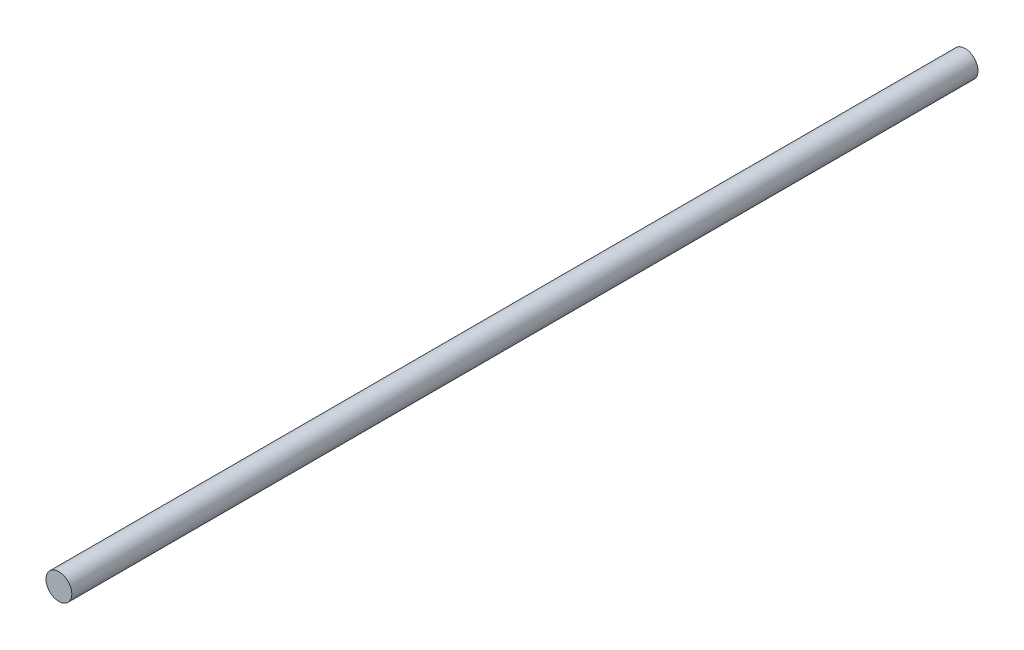
from build123d import *

# Parameters (mm, degrees)
SKETCH1_R           = 3.6195
BOSS_EXTRUDE1_DEPTH = 254


with BuildPart() as part:
    # Sketch1 → Boss-Extrude1 (new body)
    with BuildSketch(Plane.XY):
        Circle(SKETCH1_R)
    extrude(amount=BOSS_EXTRUDE1_DEPTH)


solid = part.part
